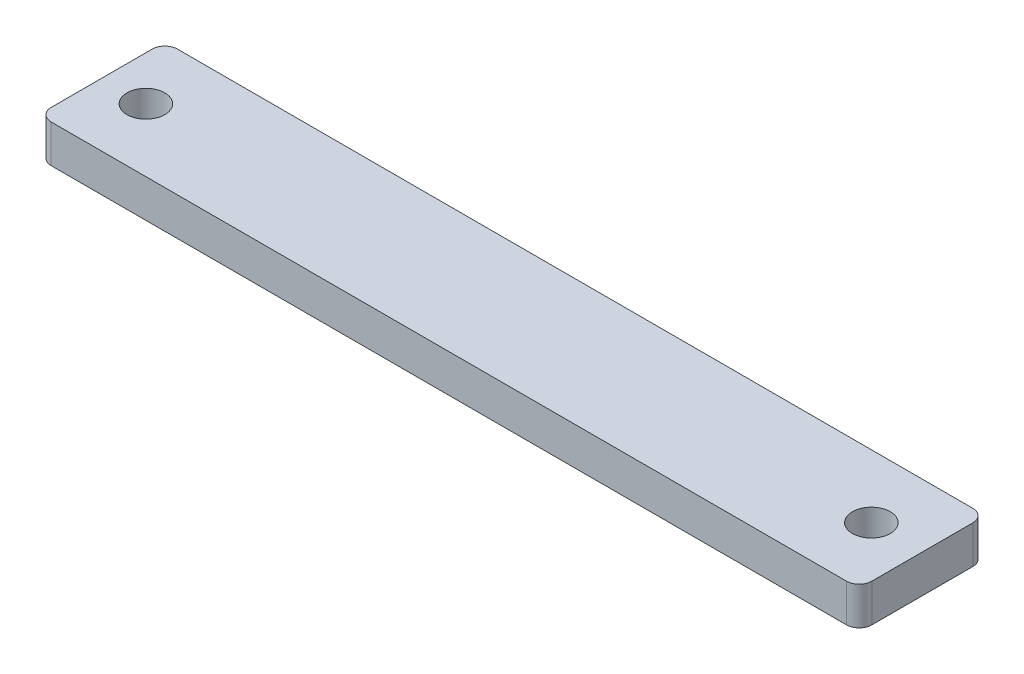
from build123d import *

# Parameters (mm, degrees)
CROQUIS1_W              = 65
CROQUIS1_H              = 10
CROQUIS1_R              = 1.5
SALIENTE_EXTRUIR1_DEPTH = 3
REDONDEO1_R             = 1


with BuildPart() as part:
    # Croquis1 → Saliente-Extruir1 (new body)
    with BuildSketch(Plane(origin=(0, 0, 0), x_dir=(1, 0, 0), z_dir=(0, 1, 0))):
        with Locations((0.267609294, 1.070437174)):
            Rectangle(CROQUIS1_W, CROQUIS1_H)
        with Locations(Location((-28.732390706, 1.070437174, 0), (0, 0, 270))):
            Circle(CROQUIS1_R, mode=Mode.SUBTRACT)
        with Locations(Location((28.732390706, 1.070437174, 0), (0, 0, 90))):
            Circle(CROQUIS1_R, mode=Mode.SUBTRACT)
    extrude(amount=SALIENTE_EXTRUIR1_DEPTH)

    # Redondeo1
    redondeo1_edges = [part.edges().sort_by_distance(p)[0] for p in [
        (32.767609294, 1.5, 3.929562826),
        (-32.232390706, 1.5, 3.929562826),
        (-32.232390706, 1.5, -6.070437174),
        (32.767609294, 1.5, -6.070437174),
    ]]
    fillet(redondeo1_edges, radius=REDONDEO1_R)


solid = part.part
